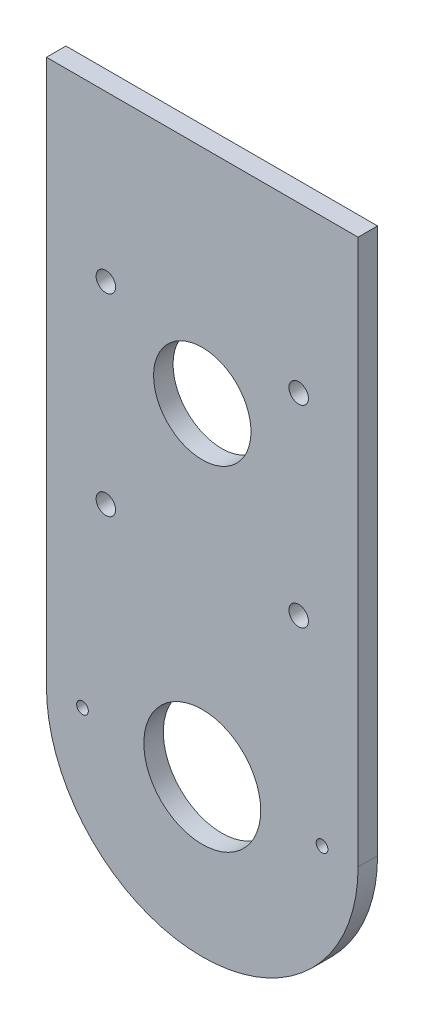
from build123d import *

# Parameters (mm, degrees)
SKETCH1_R           = 15
BOSS_EXTRUDE1_DEPTH = 5
SKETCH2_R           = 2.5
SKETCH2_R_2         = 12.5
CUT_EXTRUDE1_DEPTH  = 146.688022843
SKETCH3_R           = 1.5
CUT_EXTRUDE2_DEPTH  = 10


with BuildPart() as part:
    # Sketch1 → Boss-Extrude1 (new body)
    with BuildSketch(Plane.XY):
        with BuildLine():
            Line((-40, 0), (-40, 140))
            Line((-40, 140), (40, 140))
            Line((40, 140), (40, 0))
            ThreePointArc((40, 0), (0, -40), (-40, 0))
        make_face()
        Circle(SKETCH1_R, mode=Mode.SUBTRACT)
    extrude(amount=BOSS_EXTRUDE1_DEPTH)

    # Sketch2 → Cut-Extrude1 (cut, through all)
    with BuildSketch(Plane(origin=(0, 0, 0), x_dir=(-1, 0, 0), z_dir=(0, 0, -1))):
        with Locations((-24.75, 97.75)):
            Circle(SKETCH2_R)
        with Locations((24.75, 97.75)):
            Circle(SKETCH2_R)
        with Locations((24.75, 48.25)):
            Circle(SKETCH2_R)
        with Locations((-24.75, 48.25)):
            Circle(SKETCH2_R)
        with Locations((0, 83)):
            Circle(SKETCH2_R_2)
    extrude(amount=-CUT_EXTRUDE1_DEPTH, mode=Mode.SUBTRACT)

    # Sketch3 → Cut-Extrude2 (cut)
    with BuildSketch(Plane(origin=(0, 0, 0), x_dir=(-1, 0, 0), z_dir=(0, 0, -1))):
        with Locations((-30.75, 0)):
            Circle(SKETCH3_R)
        with Locations((30.75, 0)):
            Circle(SKETCH3_R)
    extrude(amount=-CUT_EXTRUDE2_DEPTH, mode=Mode.SUBTRACT)


solid = part.part
